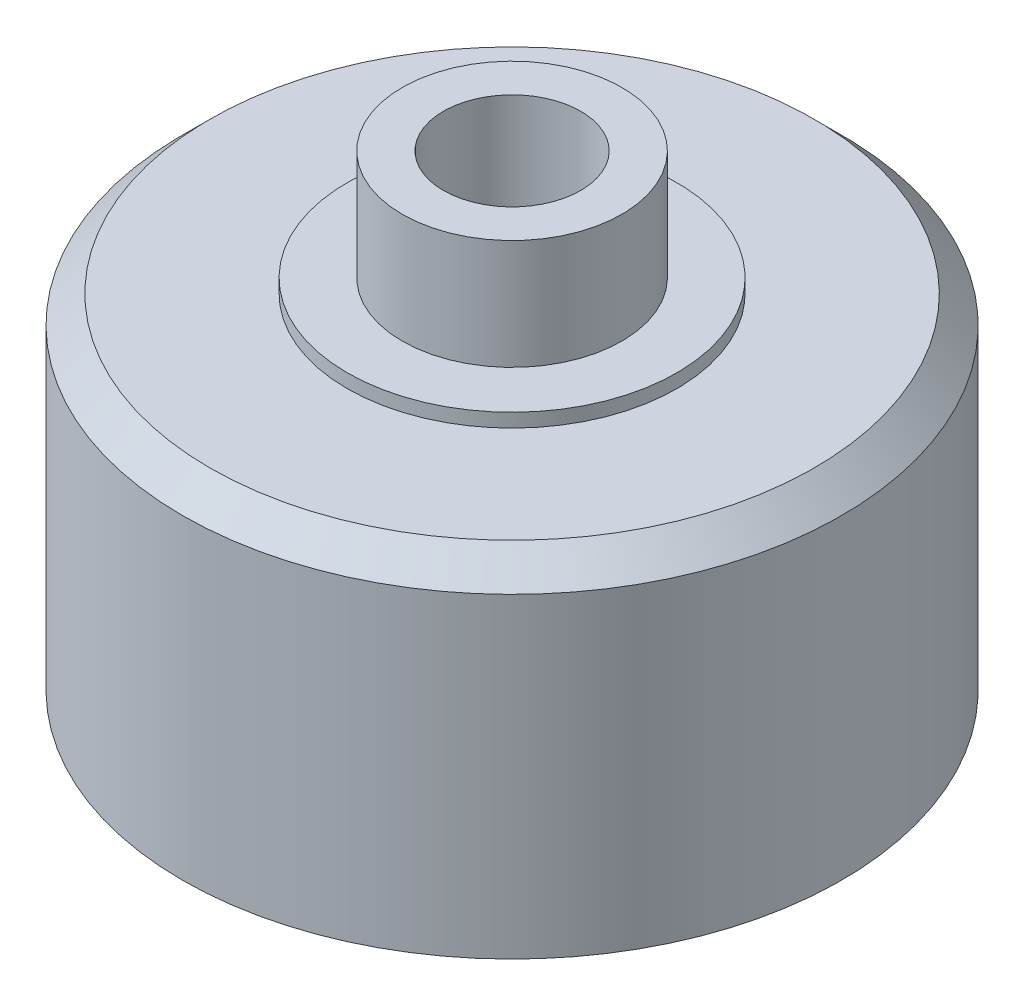
from build123d import *

# Parameters (mm, degrees)
SKETCH1_R               = 12
BOSS_EXTRUDE1_DEPTH     = 12.5
SKETCH2_R               = 4
BOSS_EXTRUDE2_DEPTH     = 4.5
SHELL1_T                = -1.5
CHAMFER2_SIZE           = 1
SKETCH3_R               = 6
SKETCH3_R_2             = 4
BOSS_EXTRUDE3_DEPTH     = 0.5
BOSS_EXTRUDE4_DEPTH     = 11
MIRROR2_COPY_1_DEPTH    = 11
SKETCH5_R               = 1.5
BOSS_EXTRUDE5_DEPTH     = 11
MIRROR4_COPY_1_SKETCH_R = 1.5
MIRROR4_COPY_1_DEPTH    = 11
SKETCH6_R               = 0.75
CUT_EXTRUDE1_DEPTH      = 8
MIRROR6_COPY_1_SKETCH_R = 0.75
MIRROR6_COPY_1_DEPTH    = 8


with BuildPart() as part:
    # Sketch1 → Boss-Extrude1 (new body)
    with BuildSketch(Plane(origin=(0, 0, 0), x_dir=(1, 0, 0), z_dir=(0, 1, 0))):
        with Locations(Location((0, 0, 0), (0, 0, 270))):
            Circle(SKETCH1_R)
    extrude(amount=BOSS_EXTRUDE1_DEPTH)

    # Sketch2 → Boss-Extrude2 (add)
    with BuildSketch(Plane(origin=(0, 12.5, 0), x_dir=(1, 0, 0), z_dir=(0, 1, 0))):
        with Locations(Location((0, 0, 0), (0, 0, 270))):
            Circle(SKETCH2_R)
    extrude(amount=BOSS_EXTRUDE2_DEPTH)

    # Shell1
    shell1_openings = [part.faces().sort_by_distance(p)[0] for p in [
        (0, 0, 0),
        (0, 17, 0),
    ]]
    offset(amount=SHELL1_T, openings=shell1_openings, kind=Kind.INTERSECTION)

    # Chamfer2
    chamfer2_edges = [part.edges().sort_by_distance(p)[0] for p in [
        (0, 12.5, -12),
    ]]
    chamfer(chamfer2_edges, length=CHAMFER2_SIZE)

    # Sketch3 → Boss-Extrude3 (add)
    with BuildSketch(Plane(origin=(0, 12.5, 0), x_dir=(1, 0, 0), z_dir=(0, 1, 0))):
        with Locations(Location((0, 0, 0), (0, 0, 270))):
            Circle(SKETCH3_R)
        with Locations(Location((0, 0, 0), (0, 0, 270))):
            Circle(SKETCH3_R_2, mode=Mode.SUBTRACT)
    extrude(amount=BOSS_EXTRUDE3_DEPTH)

    # Sketch4 → Boss-Extrude4 (add)
    with BuildSketch(Plane(origin=(0, 0, 0), x_dir=(1, 0, 0), z_dir=(0, 1, 0))):
        with BuildLine():
            Line((-2.5, -10.198039027), (-2.5, -8.392304845))
            Line((-2.5, -8.392304845), (-1.5, -8.392304845))
            Line((-1.5, -8.392304845), (-1.5, -10.392304845))
            ThreePointArc((-1.5, -10.392304845), (-2.002357311, -10.307306399), (-2.5, -10.198039027))
        make_face()
    boss_extrude4 = extrude(amount=BOSS_EXTRUDE4_DEPTH)

    # Mirror1: Boss-Extrude4 across plane
    add(boss_extrude4.mirror(Plane(origin=(0, 0, 0), x_dir=(0, 0, 1), z_dir=(1, 0, 0))))

    # Mirror2: Boss-Extrude4 across plane
    add(boss_extrude4.mirror(Plane.XY))

    # Mirror2 copy 1 sketch → Mirror2 copy 1 (add)
    with BuildSketch(Plane(origin=(0, 0, 0), x_dir=(-1, 0, 0), z_dir=(0, 1, 0))):
        with BuildLine():
            Line((-2.5, -10.198039027), (-2.5, -8.392304845))
            Line((-2.5, -8.392304845), (-1.5, -8.392304845))
            Line((-1.5, -8.392304845), (-1.5, -10.392304845))
            ThreePointArc((-1.5, -10.392304845), (-2.002357311, -10.307306399), (-2.5, -10.198039027))
        make_face()
    extrude(amount=MIRROR2_COPY_1_DEPTH)

    # Sketch5 → Boss-Extrude5 (add)
    with BuildSketch(Plane(origin=(0, 0, 0), x_dir=(1, 0, 0), z_dir=(0, 1, 0))):
        with Locations((-8.25, -6.495190528)):
            Circle(SKETCH5_R)
    boss_extrude5 = extrude(amount=BOSS_EXTRUDE5_DEPTH)

    # Mirror3: Boss-Extrude5 across plane
    add(boss_extrude5.mirror(Plane(origin=(0, 0, 0), x_dir=(0, 0, 1), z_dir=(1, 0, 0))))

    # Mirror4: Boss-Extrude5 across plane
    add(boss_extrude5.mirror(Plane.XY))

    # Mirror4 copy 1 sketch → Mirror4 copy 1 (add)
    with BuildSketch(Plane(origin=(0, 0, 0), x_dir=(-1, 0, 0), z_dir=(0, 1, 0))):
        with Locations((-8.25, -6.495190528)):
            Circle(MIRROR4_COPY_1_SKETCH_R)
    extrude(amount=MIRROR4_COPY_1_DEPTH)

    # Sketch6 → Cut-Extrude1 (cut)
    with BuildSketch(Plane(origin=(0, 0, 0), x_dir=(1, 0, 0), z_dir=(0, 1, 0))):
        with Locations(Location((-8.25, -6.495190528, 0), (0, 0, 270))):
            Circle(SKETCH6_R)
    cut_extrude1 = extrude(amount=CUT_EXTRUDE1_DEPTH, mode=Mode.SUBTRACT)

    # Mirror5: Cut-Extrude1 across plane
    add(cut_extrude1.mirror(Plane(origin=(0, 0, 0), x_dir=(0, 0, 1), z_dir=(1, 0, 0))), mode=Mode.SUBTRACT)

    # Mirror6: Cut-Extrude1 across plane
    add(cut_extrude1.mirror(Plane.XY), mode=Mode.SUBTRACT)

    # Mirror6 copy 1 sketch → Mirror6 copy 1 (cut)
    with BuildSketch(Plane(origin=(0, 0, 0), x_dir=(-1, 0, 0), z_dir=(0, 1, 0))):
        with Locations(Location((-8.25, -6.495190528, 0), (0, 0, 270))):
            Circle(MIRROR6_COPY_1_SKETCH_R)
    extrude(amount=MIRROR6_COPY_1_DEPTH, mode=Mode.SUBTRACT)


solid = part.part
